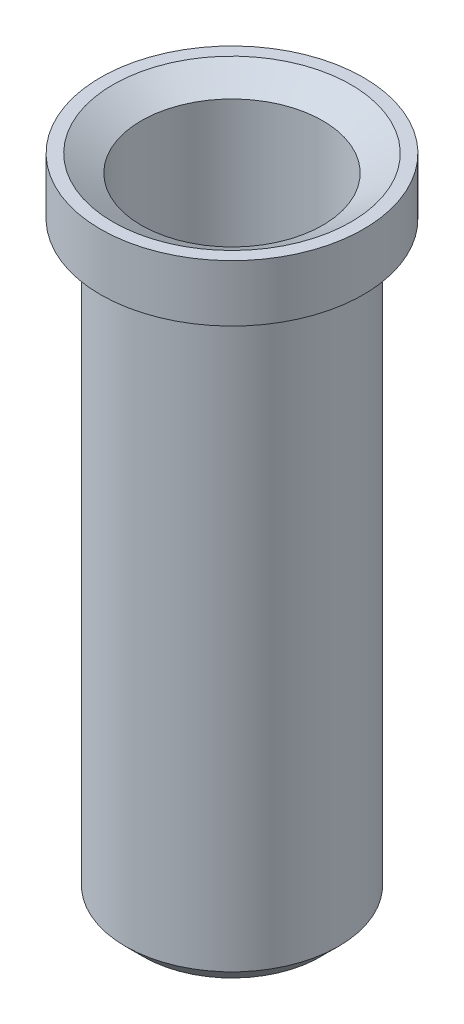
from build123d import *

# Parameters (mm, degrees)
CHAMFER_1_SIZE = 0.16


with BuildPart() as part:
    # 草图1 → 旋转1 (revolve)
    with BuildSketch(Plane.XY, mode=Mode.PRIVATE) as revolve_1_sk:
        Polygon((0, -5.25), (-0.94, -5.25), (-0.94, 0), (-1.16, 0), (-1.16, 0.5), (-1.05, 0.5), (-0.8, 0.34968967), (-0.8, -4), (0, -4.545649933), align=None)
    revolve(revolve_1_sk.sketch.rotate(Axis((0, 8.238789055, 0), (0, -1, 0)), 270), axis=Axis((0, 8.238789055, 0), (0, -1, 0)))

    # 倒角1
    chamfer_1_edges = [part.edges().sort_by_distance(p)[0] for p in [
        (0, -5.25, -0.94),
    ]]
    chamfer(chamfer_1_edges, length=CHAMFER_1_SIZE)


solid = part.part
